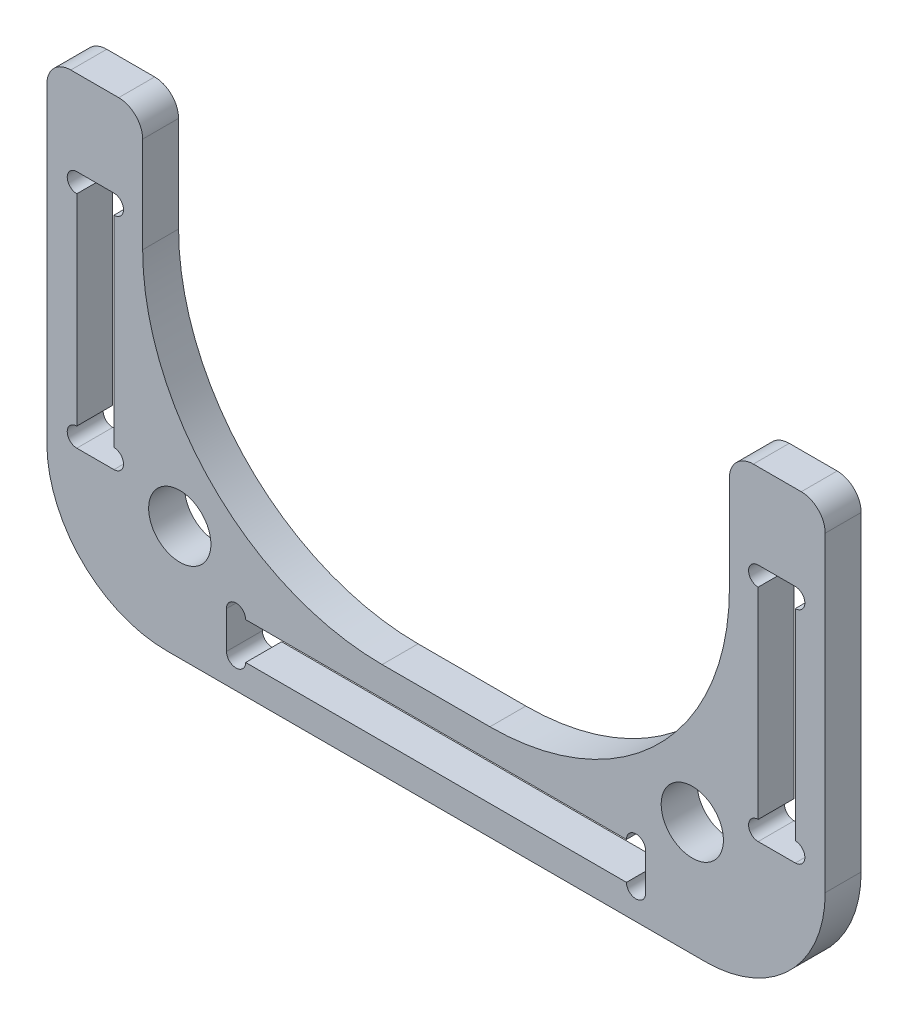
from build123d import *

# Parameters (mm, degrees)
BOSS_EXTRUDE1_DEPTH = 3
FILLET1_R           = 20
CUT_EXTRUDE1_DEPTH  = 51.092414595
SKETCH3_R           = 2.6
CUT_EXTRUDE2_DEPTH  = 51.092414595
FILLET2_R           = 10
FILLET3_R           = 2


with BuildPart() as part:
    # Sketch1 → Boss-Extrude1 (new body)
    with BuildSketch(Plane.XY):
        Polygon((0, 0), (-32.5, 0), (-32.5, 38), (-24.5, 38), (-24.5, 8), (0, 8), (24.5, 8), (24.5, 38), (32.5, 38), (32.5, 0), align=None)
    extrude(amount=BOSS_EXTRUDE1_DEPTH)

    # Fillet1
    fillet1_edges = [part.edges().sort_by_distance(p)[0] for p in [
        (24.5, 8, 1.5),
        (-24.5, 8, 1.5),
    ]]
    fillet(fillet1_edges, radius=FILLET1_R)

    # Sketch2 → Cut-Extrude1 (cut, through all)
    with BuildSketch(Plane.XY.offset(3)):
        with BuildLine():
            Line((-30, 10.9), (-26.9, 10.9))
            ThreePointArc((-26.9, 10.9), (-26.1, 11.7), (-26.9, 12.5))
            Line((-26.9, 12.5), (-26.9, 29.3))
            ThreePointArc((-26.9, 29.3), (-26.1, 30.1), (-26.9, 30.9))
            Line((-26.9, 30.9), (-30, 30.9))
            ThreePointArc((-30, 30.9), (-30.8, 30.1), (-30, 29.3))
            Line((-30, 29.3), (-30, 12.5))
            ThreePointArc((-30, 12.5), (-30.8, 11.7), (-30, 10.9))
        make_face()
        with BuildLine():
            Line((26.9, 12.5), (26.9, 29.3))
            ThreePointArc((26.9, 29.3), (26.1, 30.1), (26.9, 30.9))
            Line((26.9, 30.9), (30, 30.9))
            ThreePointArc((30, 30.9), (30.8, 30.1), (30, 29.3))
            Line((30, 29.3), (30, 12.5))
            ThreePointArc((30, 12.5), (30.8, 11.7), (30, 10.9))
            Line((30, 10.9), (26.9, 10.9))
            ThreePointArc((26.9, 10.9), (26.1, 11.7), (26.9, 12.5))
        make_face()
        with BuildLine():
            Line((-15.9, 2.45), (15.9, 2.45))
            ThreePointArc((15.9, 2.45), (16.7, 1.65), (17.5, 2.45))
            Line((17.5, 2.45), (17.5, 5.55))
            ThreePointArc((17.5, 5.55), (16.7, 6.35), (15.9, 5.55))
            Line((15.9, 5.55), (-15.9, 5.55))
            ThreePointArc((-15.9, 5.55), (-16.7, 6.35), (-17.5, 5.55))
            Line((-17.5, 5.55), (-17.5, 2.45))
            ThreePointArc((-17.5, 2.45), (-16.7, 1.65), (-15.9, 2.45))
        make_face()
    extrude(amount=-CUT_EXTRUDE1_DEPTH, mode=Mode.SUBTRACT)

    # Sketch3 → Cut-Extrude2 (cut, through all)
    with BuildSketch(Plane.XY.offset(3)):
        with Locations((-21.4, 9.55)):
            Circle(SKETCH3_R)
        with Locations(Location((21.4, 9.55, 0), (0, 0, 180))):
            Circle(SKETCH3_R)
    extrude(amount=-CUT_EXTRUDE2_DEPTH, mode=Mode.SUBTRACT)

    # Fillet2
    fillet2_edges = [part.edges().sort_by_distance(p)[0] for p in [
        (32.5, 0, 1.5),
        (-32.5, 0, 1.5),
    ]]
    fillet(fillet2_edges, radius=FILLET2_R)

    # Fillet3
    fillet3_edges = [part.edges().sort_by_distance(p)[0] for p in [
        (24.5, 38, 1.5),
        (32.5, 38, 1.5),
        (-32.5, 38, 1.5),
        (-24.5, 38, 1.5),
    ]]
    fillet(fillet3_edges, radius=FILLET3_R)


solid = part.part
